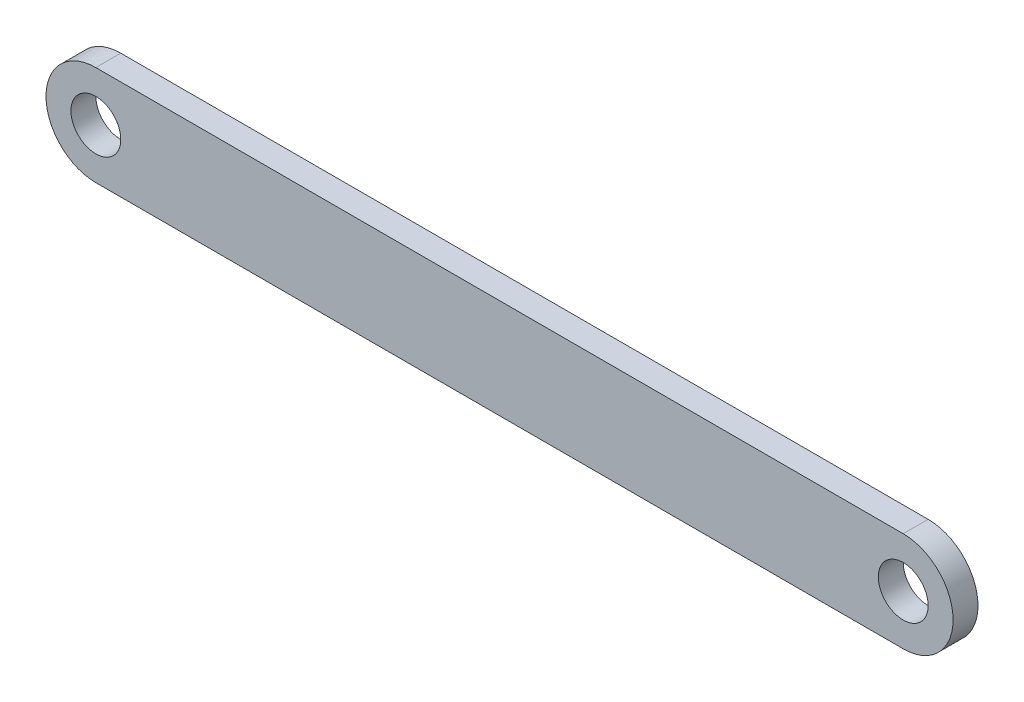
from build123d import *

# Parameters (mm, degrees)
SKETCH_1_R      = 1
EXTRUDE_1_DEPTH = 0.5


with BuildPart() as part:
    # Эскиз1 → Бобышка-Вытянуть1 (new, symmetric)
    with BuildSketch(Plane.XY):
        with BuildLine():
            Line((0, 2), (-32.398, 2))
            ThreePointArc((-32.398, 2), (-34.398, 0), (-32.398, -2))
            Line((-32.398, -2), (0, -2))
            ThreePointArc((0, -2), (2, 0), (0, 2))
        make_face()
        with Locations((-32.398, 0)):
            Circle(SKETCH_1_R, mode=Mode.SUBTRACT)
        Circle(SKETCH_1_R, mode=Mode.SUBTRACT)
    extrude(amount=EXTRUDE_1_DEPTH, both=True)


solid = part.part
